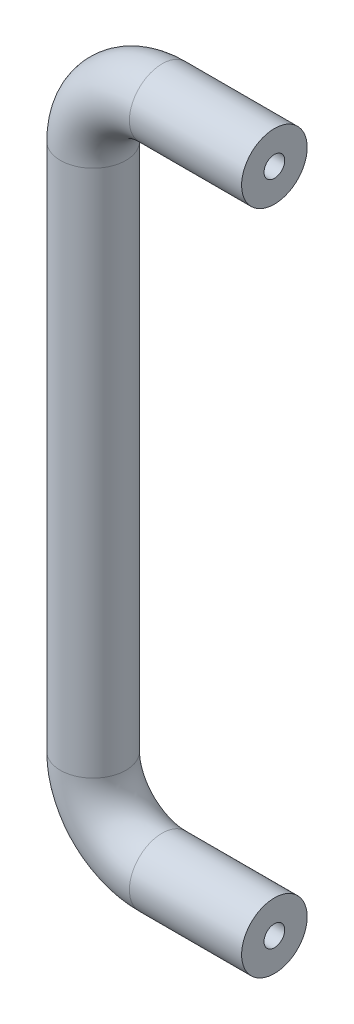
from build123d import *

# Parameters (mm, degrees)
ESBO_O2_R             = 4.75
ESBO_O3_R             = 1.5
CORTE_EXTRUS_O1_DEPTH = 10


with BuildPart() as part:
    # Varredura1: sweep along a path in Esboço1
    with BuildLine(Plane.XY) as varredura1_path:
        Line((0, 0), (-16.25, 0))
        ThreePointArc((-16.25, 0), (-23.321067812, -2.928932188), (-26.25, -10))
        Line((-26.25, -10), (-26.25, -86.5))
        ThreePointArc((-26.25, -86.5), (-23.321067812, -93.571067812), (-16.25, -96.5))
        Line((-16.25, -96.5), (0, -96.5))
    # Esboço2 → Varredura1 (sweep)
    with BuildSketch(Plane(origin=(0, 0, 0), x_dir=(0, 0, -1), z_dir=(1, 0, 0))):
        Circle(ESBO_O2_R)
    sweep(path=varredura1_path.line)

    # Esboço3 → Corte-extrusão1 (cut)
    with BuildSketch(Plane(origin=(0, 0, 0), x_dir=(0, 0, -1), z_dir=(1, 0, 0))):
        Circle(ESBO_O3_R)
        with Locations((0, -96.5)):
            Circle(ESBO_O3_R)
    extrude(amount=-CORTE_EXTRUS_O1_DEPTH, mode=Mode.SUBTRACT)


solid = part.part
